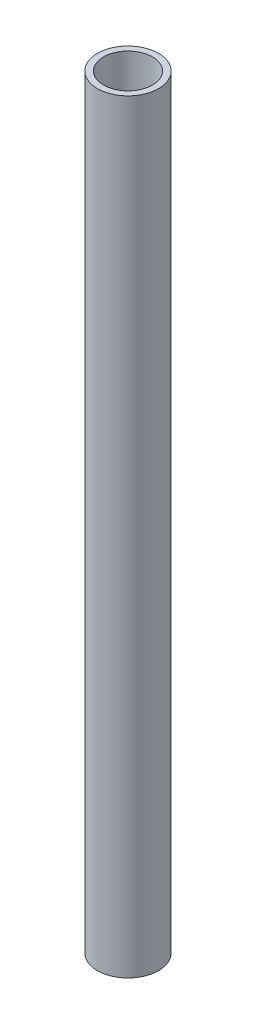
from build123d import *

# Parameters (mm, degrees)
SKETCH1_R           = 4
BOSS_EXTRUDE1_DEPTH = 100
SKETCH3_R           = 3.2
CUT_EXTRUDE3_DEPTH  = 101.159872204


with BuildPart() as part:
    # Sketch1 → Boss-Extrude1 (new body)
    with BuildSketch(Plane(origin=(0, 0, 0), x_dir=(1, 0, 0), z_dir=(0, 1, 0))):
        with Locations(Location((0, 0, 0), (0, 0, 270))):
            Circle(SKETCH1_R)
    extrude(amount=-BOSS_EXTRUDE1_DEPTH)

    # Sketch3 → Cut-Extrude3 (cut, through all)
    with BuildSketch(Plane(origin=(0, 0, 0), x_dir=(1, 0, 0), z_dir=(0, 1, 0))):
        with Locations(Location((0, 0, 0), (0, 0, 270))):
            Circle(SKETCH3_R)
    extrude(amount=-CUT_EXTRUDE3_DEPTH, mode=Mode.SUBTRACT)


solid = part.part
